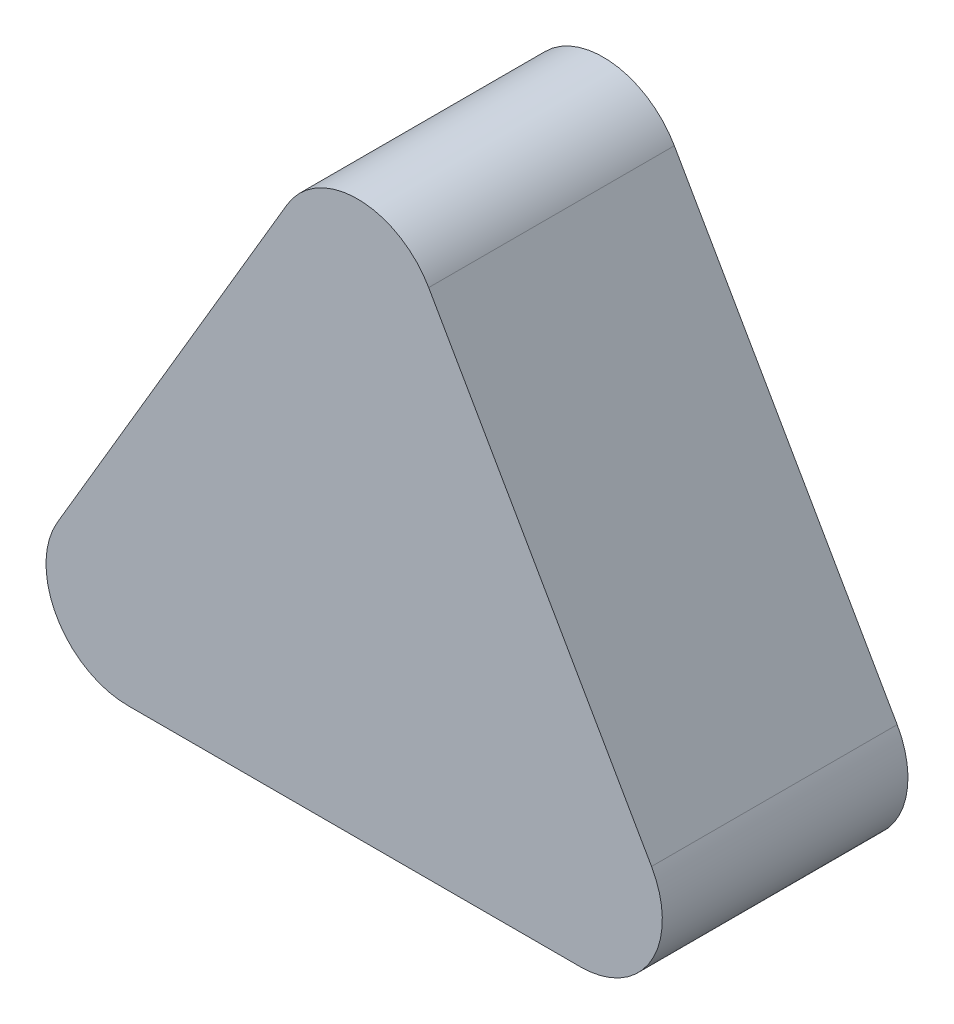
from build123d import *

# Parameters (mm, degrees)
EXTRUDE_1_DEPTH = 30
FILLET_1_R      = 10
SCALE_1_SCALE   = 2


with BuildPart() as part:
    # 草图1 → 凸台-拉伸1 (new body)
    with BuildSketch(Plane.XY):
        Polygon((-90, 0), (0, 0), (-44.31605129, 77.54338676), align=None)
    extrude(amount=EXTRUDE_1_DEPTH)

    # 圆角1
    fillet_1_edges = [part.edges().sort_by_distance(p)[0] for p in [
        (0, 0, 15),
        (-44.31605129, 77.54338676, 15),
        (-90, 0, 15),
    ]]
    fillet(fillet_1_edges, radius=FILLET_1_R)


with BuildPart() as part_1:
    # 缩放比例1: scaled about (0, 0, 0)
    add(part.part.scale(SCALE_1_SCALE))


solid = part_1.part
